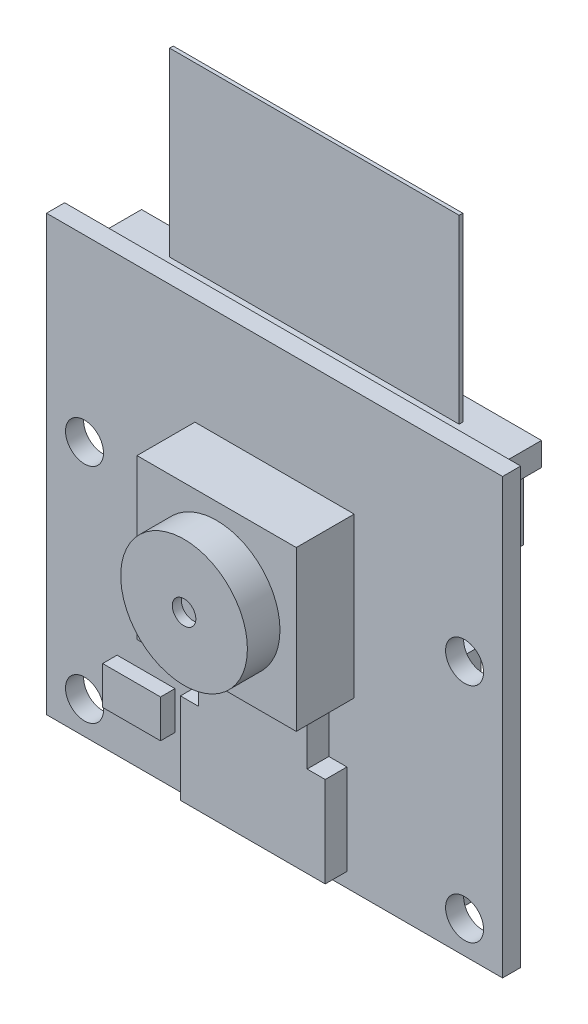
from build123d import *

# Parameters (mm, degrees)
SKICA1_W                 = 25.2
SKICA1_H                 = 24
SKICA1_R                 = 1.05
P_IDAT_VYSUNUT_M1_DEPTH  = 1
SKICA1_3_W               = 8.8
SKICA1_3_H               = 8.8
SKICA1_3_R               = 3.5
P_IDAT_VYSUNUT_M2_DEPTH  = 3.2
SKICA1_4_R               = 3.5
P_IDAT_VYSUNUT_M3_DEPTH  = 5
P_IDAT_VYSUNUT_M4_DEPTH  = 1.2
P_IDAT_VYSUNUT_M5_DEPTH  = 2.7
SKICA4_W                 = 17.9
SKICA4_H                 = 12
P_IDAT_VYSUNUT_M6_DEPTH  = 1.3
SKICA5_W                 = 3.2
SKICA5_H                 = 2.1
P_IDAT_VYSUNUT_M7_DEPTH  = 0.8
SKICA6_R                 = 0.65
ODEBRAT_VYSUNUT_M1_DEPTH = 0.5
SKICA7_W                 = 16
SKICA7_H                 = 0.2
P_IDAT_VYSUNUT_M9_DEPTH  = 10


with BuildPart() as part:
    # Skica1 → Přidat vysunutím1 (new body)
    with BuildSketch(Plane.XY):
        Rectangle(SKICA1_W, SKICA1_H)
        with Locations((-10.5, -10.2)):
            Circle(SKICA1_R, mode=Mode.SUBTRACT)
        with Locations((10.5, -10.2)):
            Circle(SKICA1_R, mode=Mode.SUBTRACT)
        with Locations((-10.5, 2.1)):
            Circle(SKICA1_R, mode=Mode.SUBTRACT)
        with Locations((10.5, 2.1)):
            Circle(SKICA1_R, mode=Mode.SUBTRACT)
    extrude(amount=-P_IDAT_VYSUNUT_M1_DEPTH)

    # Skica1<3> → Přidat vysunutím2 (add)
    with BuildSketch(Plane.XY):
        with Locations((0, 1.7)):
            Rectangle(SKICA1_3_W, SKICA1_3_H)
        with Locations((0, 1.7)):
            Circle(SKICA1_3_R, mode=Mode.SUBTRACT)
    extrude(amount=P_IDAT_VYSUNUT_M2_DEPTH)

    # Skica1<4> → Přidat vysunutím3 (add)
    with BuildSketch(Plane.XY):
        with Locations((0, 1.7)):
            Circle(SKICA1_4_R)
    extrude(amount=P_IDAT_VYSUNUT_M3_DEPTH)

    # Skica2 → Přidat vysunutím4 (add)
    with BuildSketch(Plane.XY):
        Polygon((-4, -6.2), (-4, -11.2), (4, -11.2), (4, -6.2), (3, -6.2), (3, -2.7), (-3, -2.7), (-3, -6.2), align=None)
    extrude(amount=P_IDAT_VYSUNUT_M4_DEPTH)

    # Skica3 → Přidat vysunutím5 (add)
    with BuildSketch(Plane(origin=(0, 0, -1), x_dir=(-1, 0, 0), z_dir=(0, 0, -1))):
        Polygon((-10.05, 9.8), (-10.05, 5.6), (10.05, 5.6), (10.05, 9.8), (11.05, 9.8), (11.05, 11.1), (-11.05, 11.1), (-11.05, 9.8), align=None)
    extrude(amount=P_IDAT_VYSUNUT_M5_DEPTH)

    # Skica4 → Přidat vysunutím6 (add)
    with BuildSketch(Plane(origin=(0, 0, -1), x_dir=(-1, 0, 0), z_dir=(0, 0, -1))):
        with Locations((-0.15, -5)):
            Rectangle(SKICA4_W, SKICA4_H)
    extrude(amount=P_IDAT_VYSUNUT_M6_DEPTH)

    # Skica5 → Přidat vysunutím7 (add)
    with BuildSketch(Plane.XY):
        with Locations((-7.1, -8.25)):
            Rectangle(SKICA5_W, SKICA5_H)
    extrude(amount=P_IDAT_VYSUNUT_M7_DEPTH)

    # Skica6 → Odebrat vysunutím1 (cut)
    with BuildSketch(Plane.XY.offset(5)):
        with Locations((0, 1.7)):
            Circle(SKICA6_R)
    extrude(amount=-ODEBRAT_VYSUNUT_M1_DEPTH, mode=Mode.SUBTRACT)

    # Skica7 → Přidat vysunutím9 (add)
    with BuildSketch(Plane(origin=(0, 11.1, 0), x_dir=(1, 0, 0), z_dir=(0, 1, 0))):
        with Locations((0, 2.3)):
            Rectangle(SKICA7_W, SKICA7_H)
    extrude(amount=P_IDAT_VYSUNUT_M9_DEPTH)


solid = part.part
